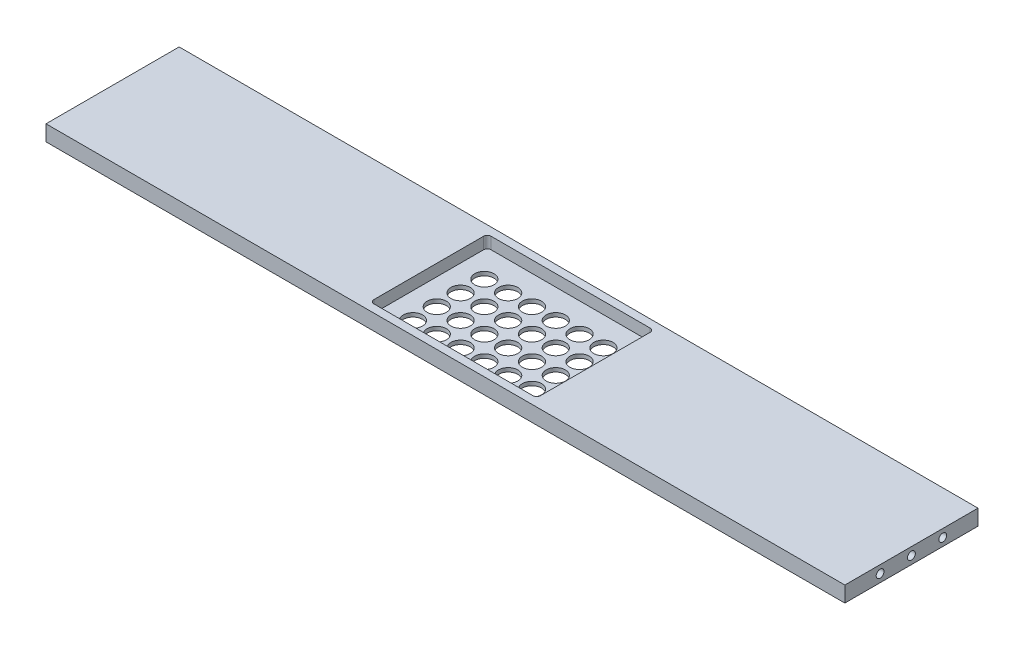
from build123d import *

# Parameters (mm, degrees)
SKETCH2_W                         = 647.7
SKETCH2_H                         = 12.7
BOSS_EXTRUDE1_DEPTH               = 53.975
CUT_EXTRUDE1_DEPTH                = 9.525
CUT_EXTRUDE2_DEPTH                = 329.45524619
CUT_EXTRUDE2_DEPTH_BACK           = 329.45524619
SKETCH4_R                         = 7.81
F_1_4_20_THREADED_HOLE_AT_2_COUNT = 2
F_1_4_20_THREADED_HOLE_AT_2_PITCH = 25.4
F_1_4_20_THREADED_HOLE_AT_3_COUNT = 2
F_1_4_20_THREADED_HOLE_AT_3_PITCH = 50.8


with BuildPart() as part:
    # Sketch2 → Boss-Extrude1 (new, symmetric)
    with BuildSketch(Plane.XY):
        with Locations((0, -6.35)):
            Rectangle(SKETCH2_W, SKETCH2_H)
    extrude(amount=BOSS_EXTRUDE1_DEPTH, both=True)

    # Sketch3 → Cut-Extrude1 (cut)
    with BuildSketch(Plane(origin=(0, 0, 0), x_dir=(1, 0, 0), z_dir=(0, 1, 0))):
        with BuildLine():
            Line((64.5, 47.5), (-64.5, 47.5))
            ThreePointArc((-64.5, 47.5), (-66.621320344, 46.621320344), (-67.5, 44.5))
            Line((-67.5, 44.5), (-67.5, -44.5))
            ThreePointArc((-67.5, -44.5), (-66.621320344, -46.621320344), (-64.5, -47.5))
            Line((-64.5, -47.5), (64.5, -47.5))
            ThreePointArc((64.5, -47.5), (66.621320344, -46.621320344), (67.5, -44.5))
            Line((67.5, -44.5), (67.5, 44.5))
            ThreePointArc((67.5, 44.5), (66.621320344, 46.621320344), (64.5, 47.5))
        make_face()
    extrude(amount=-CUT_EXTRUDE1_DEPTH, mode=Mode.SUBTRACT)

    # Sketch4 → Cut-Extrude2 (cut, two sides: drawn at the far end of the back side and taken through both)
    with BuildSketch(Plane(origin=(0, -9.525, 0), x_dir=(1, 0, 0), z_dir=(0, 1, 0)).offset(-CUT_EXTRUDE2_DEPTH_BACK)):
        with Locations(Location((-46.526, 24.116, 0), (0, 0, 270))):
            Circle(SKETCH4_R)
        with Locations(Location((-27.226, 24.116, 0), (0, 0, 270))):
            Circle(SKETCH4_R)
        with Locations(Location((-7.926, 24.116, 0), (0, 0, 270))):
            Circle(SKETCH4_R)
        with Locations(Location((11.374, 24.116, 0), (0, 0, 270))):
            Circle(SKETCH4_R)
        with Locations(Location((30.674, 24.116, 0), (0, 0, 270))):
            Circle(SKETCH4_R)
        with Locations(Location((49.974, 24.116, 0), (0, 0, 270))):
            Circle(SKETCH4_R)
        with Locations(Location((-27.226, 4.816, 0), (0, 0, 270))):
            Circle(SKETCH4_R)
        with Locations(Location((-7.926, 4.816, 0), (0, 0, 270))):
            Circle(SKETCH4_R)
        with Locations(Location((11.374, 4.816, 0), (0, 0, 270))):
            Circle(SKETCH4_R)
        with Locations(Location((30.674, 4.816, 0), (0, 0, 270))):
            Circle(SKETCH4_R)
        with Locations(Location((49.974, 4.816, 0), (0, 0, 270))):
            Circle(SKETCH4_R)
        with Locations(Location((-27.226, -14.484, 0), (0, 0, 270))):
            Circle(SKETCH4_R)
        with Locations(Location((-7.926, -14.484, 0), (0, 0, 270))):
            Circle(SKETCH4_R)
        with Locations(Location((11.374, -14.484, 0), (0, 0, 270))):
            Circle(SKETCH4_R)
        with Locations(Location((30.674, -14.484, 0), (0, 0, 270))):
            Circle(SKETCH4_R)
        with Locations(Location((49.974, -14.484, 0), (0, 0, 270))):
            Circle(SKETCH4_R)
        with Locations(Location((-27.226, -33.784, 0), (0, 0, 270))):
            Circle(SKETCH4_R)
        with Locations(Location((-7.926, -33.784, 0), (0, 0, 270))):
            Circle(SKETCH4_R)
        with Locations(Location((11.374, -33.784, 0), (0, 0, 270))):
            Circle(SKETCH4_R)
        with Locations(Location((30.674, -33.784, 0), (0, 0, 270))):
            Circle(SKETCH4_R)
        with Locations(Location((49.974, -33.784, 0), (0, 0, 270))):
            Circle(SKETCH4_R)
        with Locations(Location((-46.526, 4.816, 0), (0, 0, 270))):
            Circle(SKETCH4_R)
        with Locations(Location((-46.526, -14.484, 0), (0, 0, 270))):
            Circle(SKETCH4_R)
        with Locations(Location((-46.526, -33.784, 0), (0, 0, 270))):
            Circle(SKETCH4_R)
    extrude(amount=CUT_EXTRUDE2_DEPTH + CUT_EXTRUDE2_DEPTH_BACK, mode=Mode.SUBTRACT)

    # Sketch6 → 1/4"-20 threaded hole (revolve, cut)
    with BuildSketch(Plane(origin=(-323.85, -6.35, -25.4), x_dir=(0, 0, 1), z_dir=(0, 1, 0))):
        Polygon((0, 0), (0, 52.707732465), (3.175, 50.8), (3.175, 0), align=None)
    f_1_4_20_threaded_hole = revolve(axis=Axis((-330.2, -6.35, -25.4), (1, 0, 0)), mode=Mode.SUBTRACT)

    # 1/4"-20 threaded hole at 2: 1/4"-20 threaded hole ×2
    with Locations(*[(0, 0, i * F_1_4_20_THREADED_HOLE_AT_2_PITCH) for i in range(1, F_1_4_20_THREADED_HOLE_AT_2_COUNT)]):
        add(f_1_4_20_threaded_hole, mode=Mode.SUBTRACT)

    # 1/4"-20 threaded hole at 3: 1/4"-20 threaded hole ×2
    with Locations(*[(0, 0, i * F_1_4_20_THREADED_HOLE_AT_3_PITCH) for i in range(1, F_1_4_20_THREADED_HOLE_AT_3_COUNT)]):
        add(f_1_4_20_threaded_hole, mode=Mode.SUBTRACT)

    # Mirror1: 1/4"-20 threaded hole across plane
    add(f_1_4_20_threaded_hole.mirror(Plane(origin=(0, 0, 0), x_dir=(0, 0, 1), z_dir=(1, 0, 0))), mode=Mode.SUBTRACT)

    # Mirror1 copy 1 sketch → Mirror1 copy 1 (revolve, cut)
    with BuildSketch(Plane(origin=(323.85, -6.35, 0), x_dir=(0, 0, 1), z_dir=(0, 1, 0))):
        Polygon((0, 0), (0, -52.707732465), (3.175, -50.8), (3.175, 0), align=None)
    revolve(axis=Axis((330.2, -6.35, 0), (1, 0, 0)), mode=Mode.SUBTRACT)

    # Mirror1 copy 2 sketch → Mirror1 copy 2 (revolve, cut)
    with BuildSketch(Plane(origin=(323.85, -6.35, 25.4), x_dir=(0, 0, 1), z_dir=(0, 1, 0))):
        Polygon((0, 0), (0, -52.707732465), (3.175, -50.8), (3.175, 0), align=None)
    revolve(axis=Axis((330.2, -6.35, 25.4), (1, 0, 0)), mode=Mode.SUBTRACT)


solid = part.part
